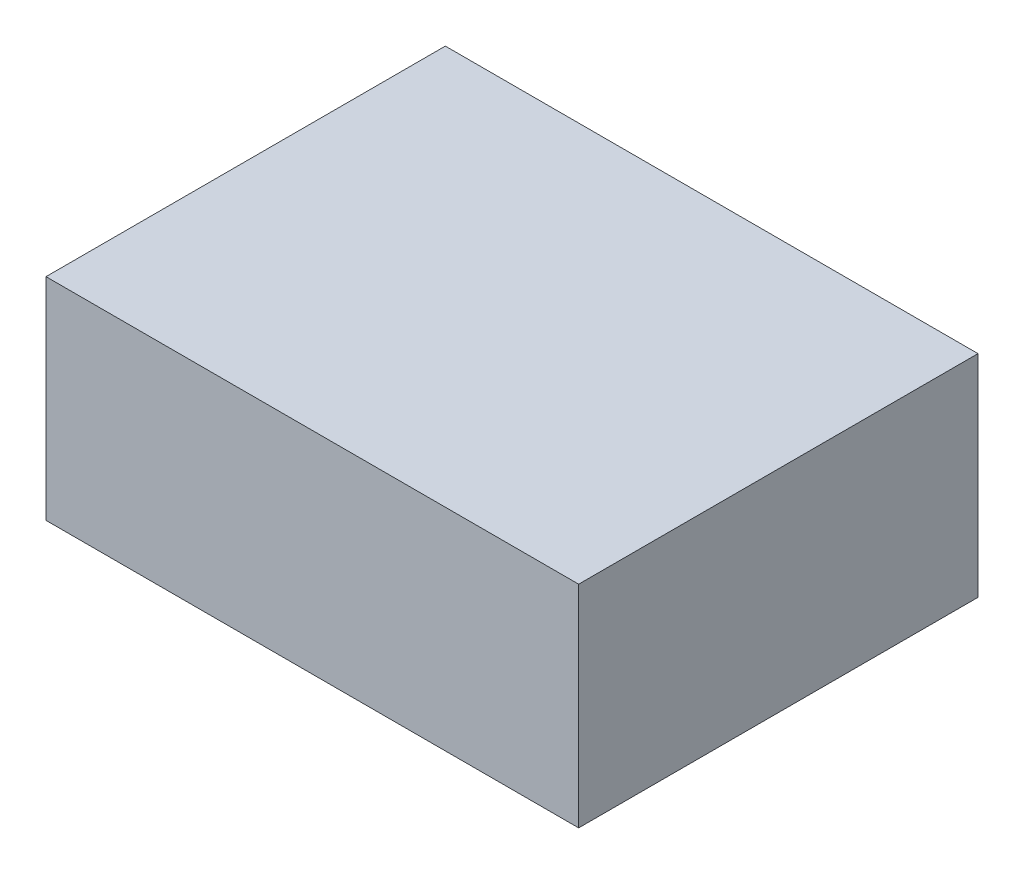
from build123d import *

# Parameters (mm, degrees)
SKETCH1_W           = 8.63
SKETCH1_H           = 6.47
BOSS_EXTRUDE1_DEPTH = 3.42


with BuildPart() as part:
    # Sketch1 → Boss-Extrude1 (new body)
    with BuildSketch(Plane(origin=(0, 0, 0), x_dir=(1, 0, 0), z_dir=(0, 1, 0))):
        Rectangle(SKETCH1_W, SKETCH1_H)
    extrude(amount=BOSS_EXTRUDE1_DEPTH)


solid = part.part
